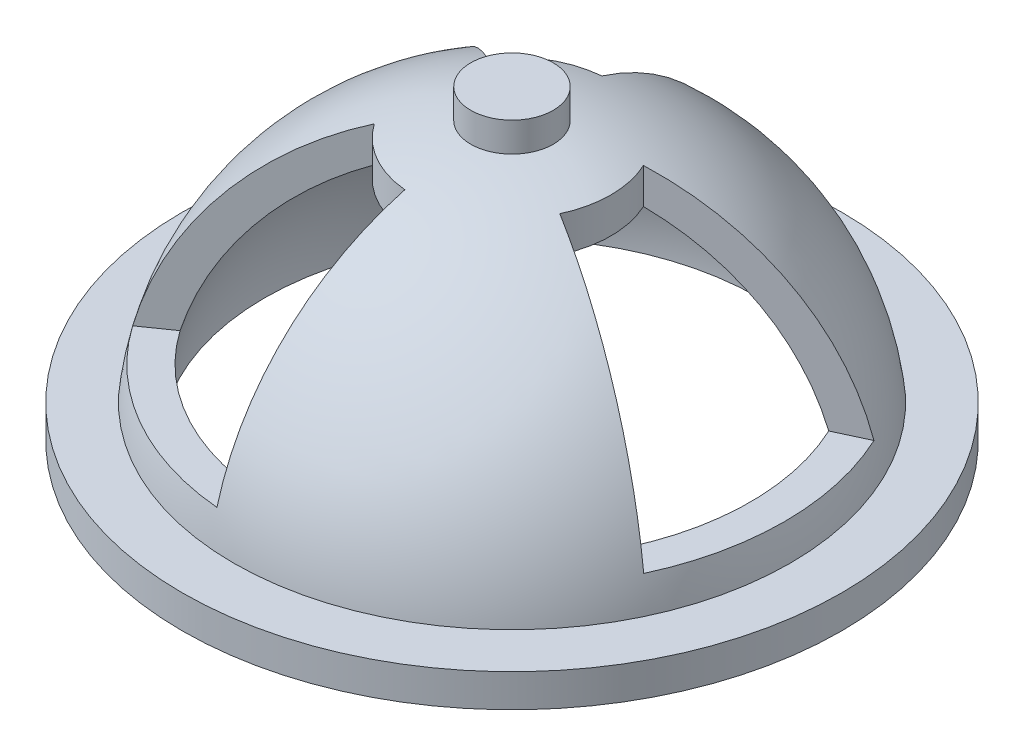
from build123d import *

# Parameters (mm, degrees)
CUT_REVOLVE_1_ANGLE      = 50
PATTERN_CIRCULAR_1_COUNT = 3


with BuildPart() as part:
    # 草图1 → 旋转1 (revolve)
    with BuildSketch(Plane.XY):
        with BuildLine():
            Line((0, 37.5), (0, 46.5))
            Line((0, 46.5), (6.25, 46.5))
            Line((6.25, 46.5), (6.25, 42.037929302))
            ThreePointArc((6.25, 42.037929302), (30.49459553, 29.60286546), (42.20485754, 5))
            Line((42.20485754, 5), (50, 5))
            Line((50, 5), (50, 0))
            Line((50, 0), (37.5, 0))
            ThreePointArc((37.5, 0), (26.516504294, 26.516504294), (0, 37.5))
        make_face()
    revolve(axis=Axis((0, 37.5, 0), (0, 1, 0)))

    # 草图2 → 切除-旋转1 (revolve, symmetric, cut)
    with BuildSketch(Plane.XY) as cut_revolve_1_sk:
        with BuildLine():
            Line((15, 39.764934301), (15, 34.369317712))
            ThreePointArc((15, 34.369317712), (28.325677697, 24.574498632), (36.142080737, 10))
            Line((36.142080737, 10), (41.306779105, 10))
            ThreePointArc((41.306779105, 10), (31.844955201, 28.145138625), (15, 39.764934301))
        make_face()
    cut_revolve_1 = revolve(axis=Axis((0, 61.674672097, 0), (0, -1, 0)), revolution_arc=CUT_REVOLVE_1_ANGLE / 2, mode=Mode.SUBTRACT)
    cut_revolve_1 = cut_revolve_1 + revolve(cut_revolve_1_sk.sketch, axis=Axis((0, 61.674672097, 0), (0, 1, 0)), revolution_arc=CUT_REVOLVE_1_ANGLE / 2, mode=Mode.SUBTRACT)

    # 阵列(圆周)1: 切除-旋转1 ×3 about axis
    pattern_circular_1_axis = Axis((0, 0, 0), (0, 1, 0))
    for i in range(1, PATTERN_CIRCULAR_1_COUNT):
        add(cut_revolve_1.rotate(pattern_circular_1_axis, i * 360 / PATTERN_CIRCULAR_1_COUNT), mode=Mode.SUBTRACT)


solid = part.part
